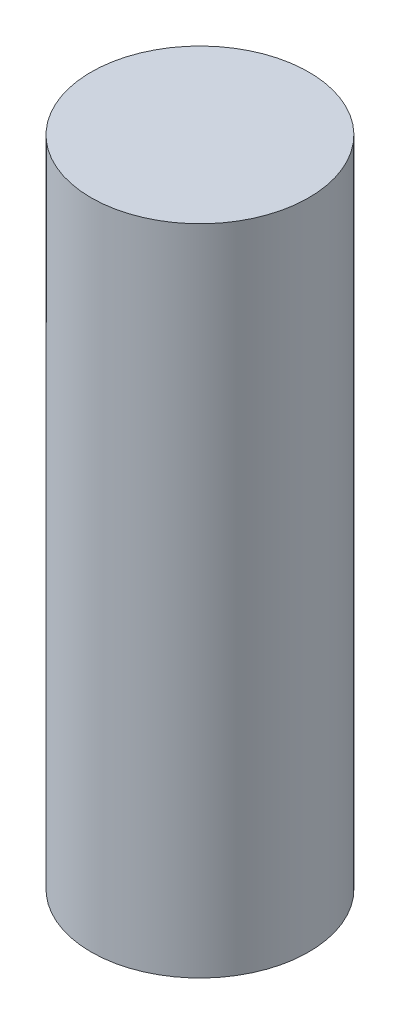
from build123d import *

# Parameters (mm, degrees)
SKETCH1_R           = 63.5
BOSS_EXTRUDE1_DEPTH = 381


with BuildPart() as part:
    # Sketch1 → Boss-Extrude1 (new body)
    with BuildSketch(Plane(origin=(0, 0, 0), x_dir=(1, 0, 0), z_dir=(0, 1, 0))):
        with Locations(Location((0, 0, 0), (0, 0, 270))):
            Circle(SKETCH1_R)
    extrude(amount=BOSS_EXTRUDE1_DEPTH)


solid = part.part
